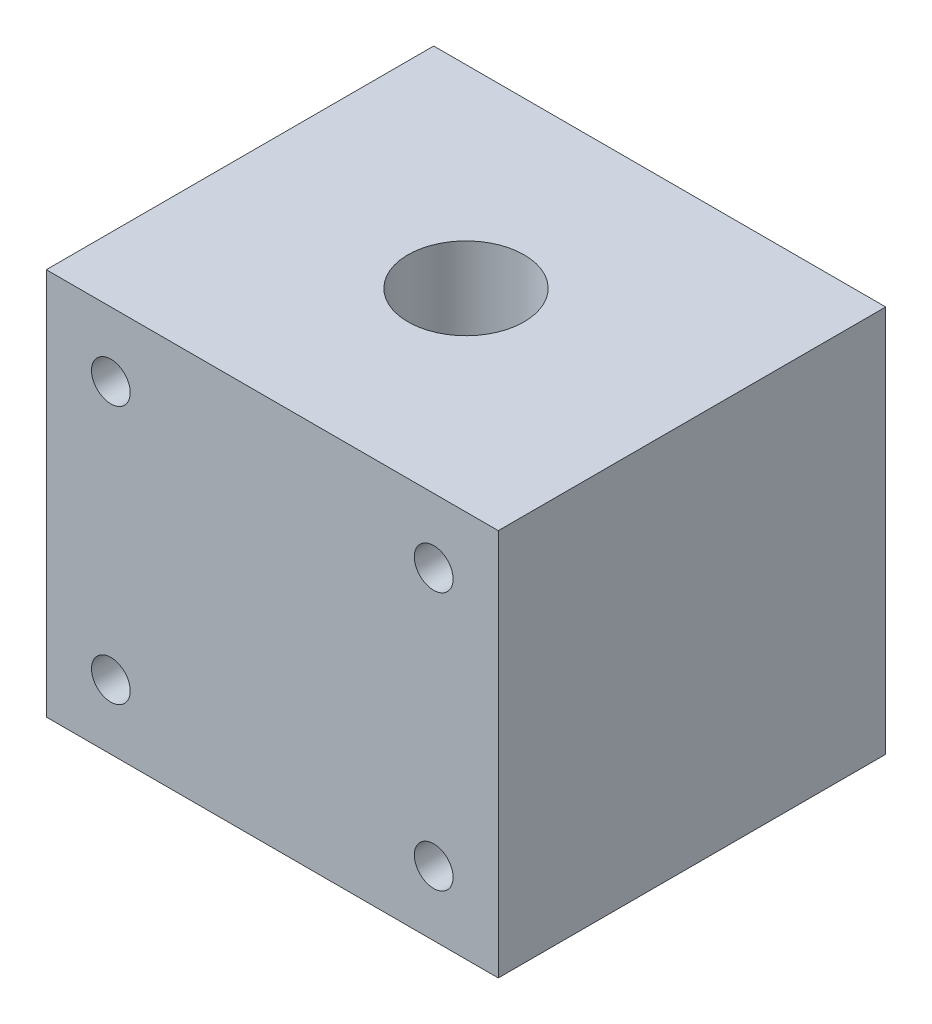
from build123d import *

# Parameters (mm, degrees)
SKETCH1_W               = 35
SKETCH1_H               = 30
BOSS_EXTRUDE1_DEPTH     = 30
SKETCH2_R               = 1.5
CUT_EXTRUDE1_DEPTH      = 10
SKETCH5_R               = 11
CUT_EXTRUDE4_DEPTH      = 3
CUT_EXTRUDE5_DEPTH      = 36.5
CUT_EXTRUDE5_DEPTH_BACK = 36.5
SKETCH6_R               = 4.5


with BuildPart() as part:
    # Sketch1 → Boss-Extrude1 (new body)
    with BuildSketch(Plane(origin=(0, 0, 0), x_dir=(1, 0, 0), z_dir=(0, 1, 0))):
        Rectangle(SKETCH1_W, SKETCH1_H)
    extrude(amount=BOSS_EXTRUDE1_DEPTH)

    # Sketch2 → Cut-Extrude1 (cut)
    with BuildSketch(Plane.XY.offset(15)):
        with Locations((-12.5, 25)):
            Circle(SKETCH2_R)
        with Locations((12.5, 25)):
            Circle(SKETCH2_R)
        with Locations((12.5, 5)):
            Circle(SKETCH2_R)
        with Locations((-12.5, 5)):
            Circle(SKETCH2_R)
    extrude(amount=-CUT_EXTRUDE1_DEPTH, mode=Mode.SUBTRACT)

    # Sketch5 → Cut-Extrude4 (cut)
    with BuildSketch(Plane.XZ):
        with Locations(Location((0, 0, 0), (0, 0, 270))):
            Circle(SKETCH5_R)
    extrude(amount=-CUT_EXTRUDE4_DEPTH, mode=Mode.SUBTRACT)

    # Sketch6 → Cut-Extrude5 (cut, two sides: drawn at the far end of the back side and taken through both)
    with BuildSketch(Plane(origin=(0, 3, 0), x_dir=(-1, 0, 0), z_dir=(0, -1, 0)).offset(-CUT_EXTRUDE5_DEPTH_BACK)):
        with Locations(Location((0, 0, 0), (0, 0, 90))):
            Circle(SKETCH6_R)
    extrude(amount=CUT_EXTRUDE5_DEPTH + CUT_EXTRUDE5_DEPTH_BACK, mode=Mode.SUBTRACT)


solid = part.part
